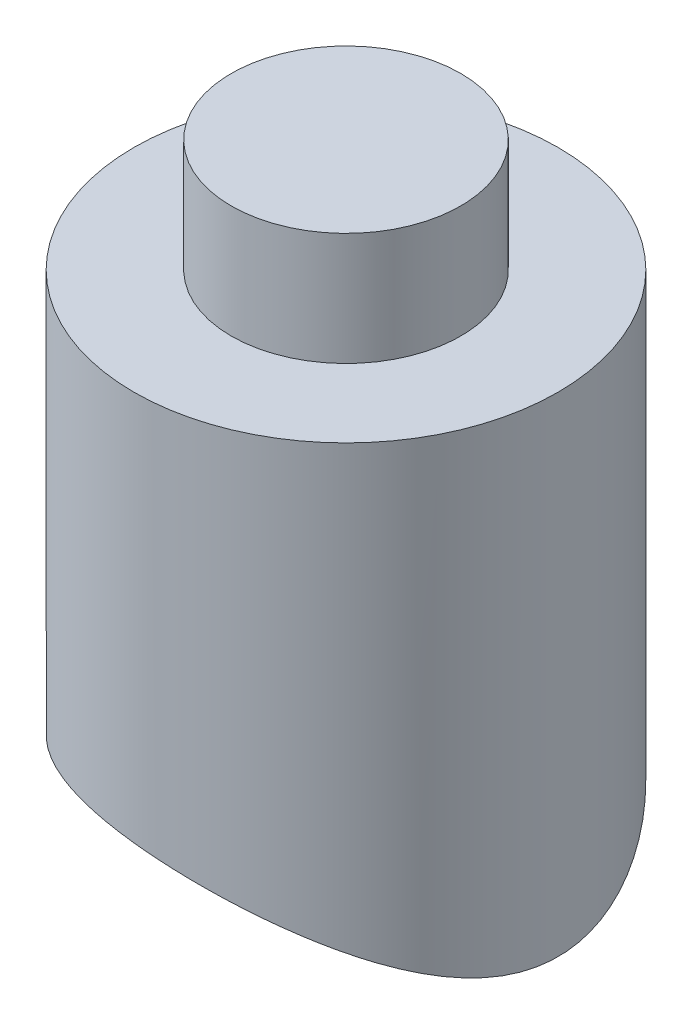
from build123d import *

# Parameters (mm, degrees)
SKETCH1_R           = 1.375
BOSS_EXTRUDE1_DEPTH = 1.35
SKETCH2_R           = 2.54
BOSS_EXTRUDE2_DEPTH = 9.144
SKETCH3_R           = 4.5
CUT_EXTRUDE1_DEPTH  = 3.81


with BuildPart() as part:
    # Sketch1 → Boss-Extrude1 (new body)
    with BuildSketch(Plane(origin=(0, 0, 0), x_dir=(1, 0, 0), z_dir=(0, 1, 0))):
        with Locations(Location((0, 0, 0), (0, 0, 90))):
            Circle(SKETCH1_R)
    extrude(amount=BOSS_EXTRUDE1_DEPTH)

    # Sketch2 → Boss-Extrude2 (add)
    with BuildSketch(Plane.XZ):
        with Locations(Location((0, 0, 0), (0, 0, 270))):
            Circle(SKETCH2_R)
    extrude(amount=BOSS_EXTRUDE2_DEPTH)

    # Sketch3 → Cut-Extrude1 (cut, symmetric)
    with BuildSketch(Plane.XY):
        with Locations((-0.5334, -9.144)):
            Circle(SKETCH3_R)
    extrude(amount=CUT_EXTRUDE1_DEPTH, both=True, mode=Mode.SUBTRACT)


solid = part.part
